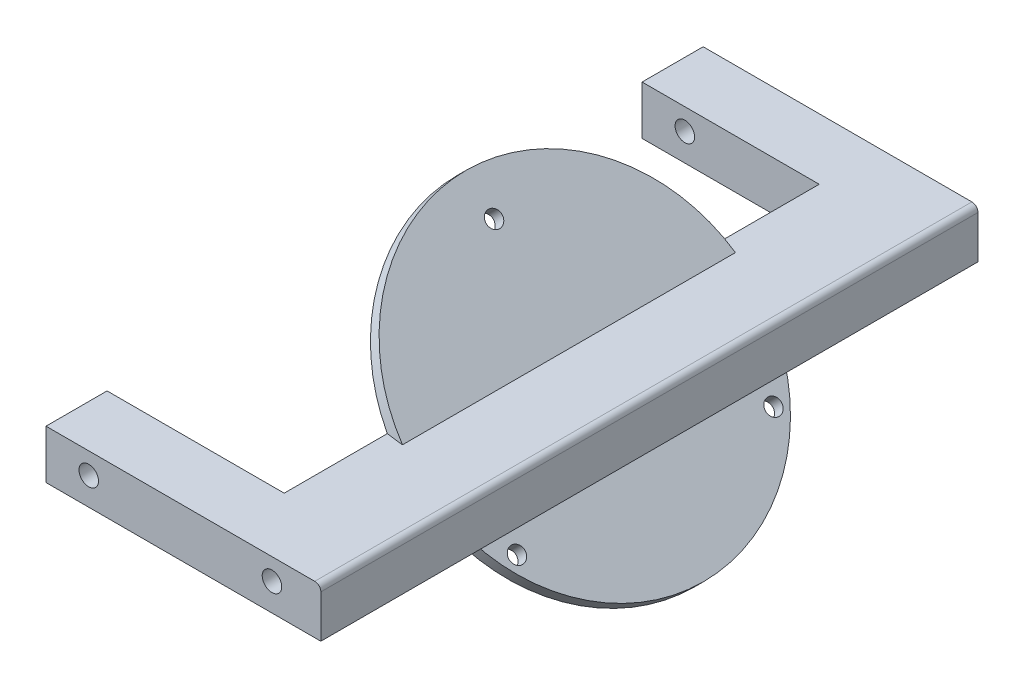
from build123d import *

# Parameters (mm, degrees)
BASE_DEPTH                 = 53.8
SKETCH4_R                  = 27.5
BOSS_EXTRUDE2_DEPTH        = 2
M2_CLEARANCE_HOLE1_D       = 2.6
FILLET1_R                  = 0.5
SIDE_HOLES_D               = 3.2
SIDE_ARM_DEPTH             = 10
F_3_2_3_2_DIAMETER_HOLE1_D = 3.2
FILLET2_R                  = 1


with BuildPart() as part:
    # Sketch1 → Base (new, symmetric)
    with BuildSketch(Plane.XY):
        Polygon((8, 4), (-8, 4), (0, -4), (8, -4), align=None)
    extrude(amount=BASE_DEPTH, both=True)

    # Sketch4 → Boss-Extrude2 (add)
    with BuildSketch(Plane(origin=(-2, -2, 0), x_dir=(0, 0, 1), z_dir=(-0.7071067811865475, -0.7071067811865476, 0))):
        with Locations((0, 2.828427125)):
            Circle(SKETCH4_R)
    extrude(amount=-BOSS_EXTRUDE2_DEPTH)

    # M2 Clearance Hole1 (through all)
    with Locations(Plane(origin=(-0.585786438, -0.585786438, 0), x_dir=(0.7071067811865475, -0.7071067811865477, 0), z_dir=(0.7071067811865477, 0.7071067811865475, 0))):
        with Locations((-23.828427125, 0), (11.171572875, 21), (11.171572875, -21)):
            Hole(M2_CLEARANCE_HOLE1_D / 2)

    # Sketch8 → Revolve1 (revolve)
    with BuildSketch(Plane(origin=(-2, 2, 0), x_dir=(0, 0, 1), z_dir=(0.7071067811865437, -0.7071067811865515, 0))):
        with BuildLine():
            Line((0, 3.828427125), (0, 2.828427125))
            Line((0, 2.828427125), (-12, 2.828427125))
            Line((-12, 2.828427125), (-6.5, 10.328427125))
            ThreePointArc((-6.5, 10.328427125), (-4.596194078, 5.732233047), (0, 3.828427125))
        make_face()
    revolve(axis=Axis((-4, 0, 0), (-0.7071067811865515, -0.7071067811865437, 0)))

    # Fillet1
    fillet1_edges = [part.edges().sort_by_distance(p)[0] for p in [
        (-9.303300859, -5.303300859, 6.5),
    ]]
    fillet(fillet1_edges, radius=FILLET1_R)

    # Side Holes (through all)
    with Locations(Plane.XY.offset(53.8)):
        with Locations((0, 0.5)):
            Hole(SIDE_HOLES_D / 2)

    # Sketch9 → Side Arm (add)
    with BuildSketch(Plane.XY.offset(53.8)):
        Polygon((-8, 4), (0, -4), (-37, -4), (-37, 4), align=None)
    side_arm = extrude(amount=-SIDE_ARM_DEPTH)

    # Mirror1: Side Arm across plane
    add(side_arm.mirror(Plane.XY))

    # Ø3.2 (3.2) Diameter Hole1 (through all)
    with Locations(Plane.XY.offset(53.8)):
        with Locations((-30, 0.5)):
            Hole(F_3_2_3_2_DIAMETER_HOLE1_D / 2)

    # Fillet2
    fillet2_edges = [part.edges().sort_by_distance(p)[0] for p in [
        (8, 4, 0),
    ]]
    fillet(fillet2_edges, radius=FILLET2_R)


solid = part.part
